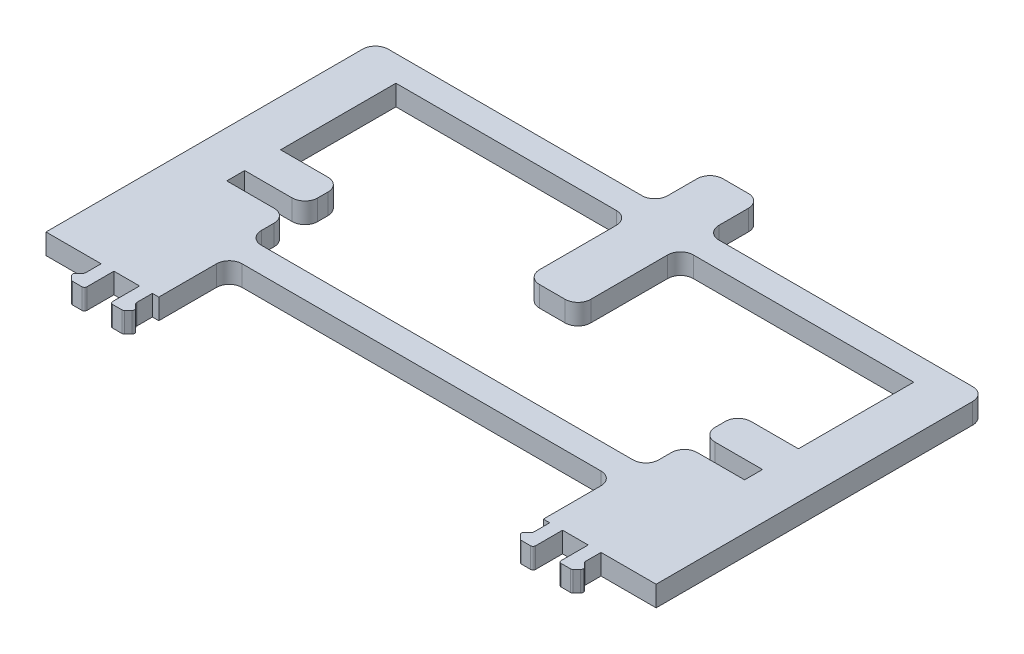
from build123d import *

# Parameters (mm, degrees)
BOSS_EXTRUDE1_DEPTH = 1.6
FILLET1_R           = 1
FILLET2_R           = 1
FILLET3_R           = 0.2


with BuildPart() as part:
    # Sketch1 → Boss-Extrude1 (new body)
    with BuildSketch(Plane(origin=(0, 0, 0), x_dir=(1, 0, 0), z_dir=(0, 1, 0))):
        Polygon((-68.929583289, 0), (-64.629583289, 0), (-64.629583289, -1.3), (-65.129583289, -1.8), (-64.629583289, -2.3), (-63.629583289, -2.3), (-63.629583289, 0), (-61.629583289, 0), (-61.629583289, -2.3), (-60.629583289, -2.3), (-60.129583289, -1.8), (-60.629583289, -1.3), (-60.629583289, 0), (-60.129583289, 0), (-60.129583289, 5.5), (-45.129583289, 5.5), (-45.129583289, 7.5), (-60.629583289, 7.5), (-60.629583289, 10.5), (-65.329583289, 10.5), (-65.329583289, 11.9), (-60.629583289, 11.9), (-60.629583289, 14.7), (-65.329583289, 14.7), (-65.329583289, 23.7), (-47.129583289, 23.7), (-47.129583289, 15.7), (-45.129583289, 15.7), (-45.129583289, 30), (-47.129583289, 30), (-47.129583289, 25.7), (-68.929583289, 25.7), (-68.929583289, 20), align=None)
    boss_extrude1 = extrude(amount=BOSS_EXTRUDE1_DEPTH)

    # Mirror1: Boss-Extrude1 across plane
    add(boss_extrude1.mirror(Plane(origin=(-45.129583289, 1.6, -15.7), x_dir=(0, 0, 1), z_dir=(-1, 0, 0))))

    # Fillet1
    fillet1_edges = [part.edges().sort_by_distance(p)[0] for p in [
        (-68.929583289, 0.8, -25.7),
        (-47.129583289, 0.8, -25.7),
        (-47.129583289, 0.8, -30),
        (-47.129583289, 0.8, -15.7),
        (-47.129583289, 0.8, -23.7),
        (-21.329583289, 0.8, -25.7),
        (-43.129583289, 0.8, -25.7),
        (-43.129583289, 0.8, -30),
        (-43.129583289, 0.8, -15.7),
        (-43.129583289, 0.8, -23.7),
    ]]
    fillet(fillet1_edges, radius=FILLET1_R)

    # Fillet2
    fillet2_edges = [part.edges().sort_by_distance(p)[0] for p in [
        (-60.629583289, 0.8, -14.7),
        (-60.629583289, 0.8, -11.9),
        (-60.629583289, 0.8, -10.5),
        (-60.629583289, 0.8, -7.5),
        (-60.129583289, 0.8, -5.5),
        (-29.629583289, 0.8, -14.7),
        (-29.629583289, 0.8, -11.9),
        (-29.629583289, 0.8, -10.5),
        (-29.629583289, 0.8, -7.5),
        (-30.129583289, 0.8, -5.5),
    ]]
    fillet(fillet2_edges, radius=FILLET2_R)

    # Fillet3
    fillet3_edges = [part.edges().sort_by_distance(p)[0] for p in [
        (-60.629583289, 0.8, 1.3),
        (-60.129583289, 0.8, 1.8),
        (-60.629583289, 0.8, 2.3),
        (-61.629583289, 0.8, 2.3),
        (-63.629583289, 0.8, 2.3),
        (-64.629583289, 0.8, 2.3),
        (-65.129583289, 0.8, 1.8),
        (-64.629583289, 0.8, 1.3),
        (-29.629583289, 0.8, 1.3),
        (-30.129583289, 0.8, 1.8),
        (-29.629583289, 0.8, 2.3),
        (-28.629583289, 0.8, 2.3),
        (-26.629583289, 0.8, 2.3),
        (-25.629583289, 0.8, 2.3),
        (-25.129583289, 0.8, 1.8),
        (-25.629583289, 0.8, 1.3),
    ]]
    fillet(fillet3_edges, radius=FILLET3_R)


solid = part.part
